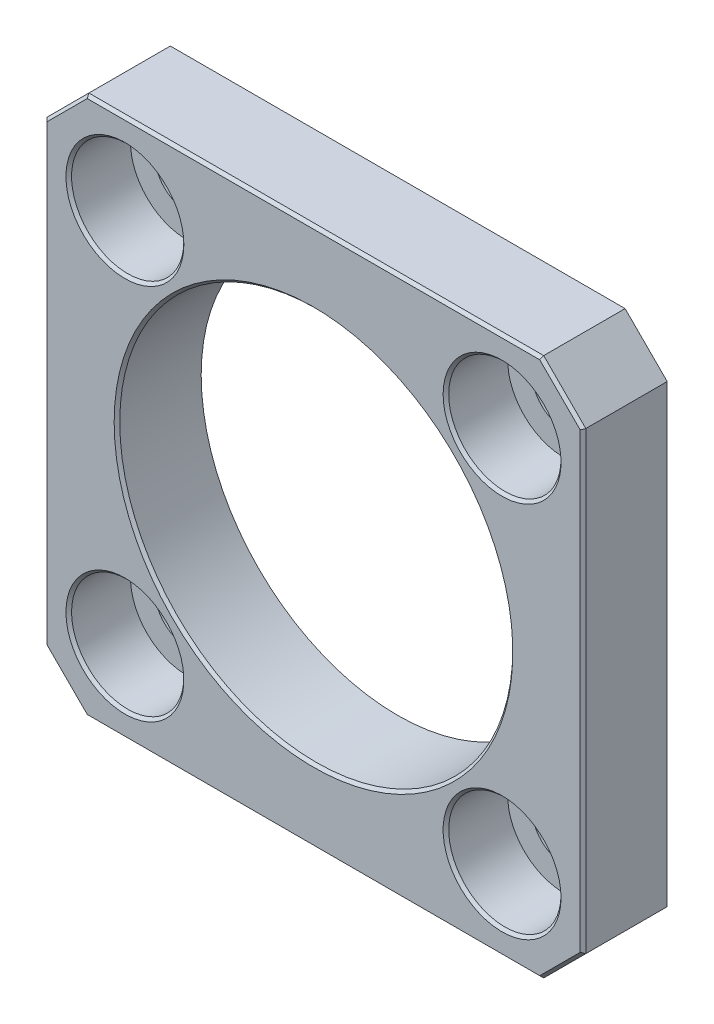
from build123d import *

# Parameters (mm, degrees)
SKETCH_1_R                   = 14
EXTRUDE_1_DEPTH              = 6
HOLE_WIZARD_M4_3_D           = 4.5
HOLE_WIZARD_M4_3_CBORE_D     = 8
HOLE_WIZARD_M4_3_CBORE_DEPTH = 4.4
PATTERN_CIRCULAR_1_COUNT     = 4
CHAMFER_1_SIZE               = 0.2


with BuildPart() as part:
    # 草圖1 → 填料-伸長1 (new body)
    with BuildSketch(Plane.XY):
        Polygon((-19.2, 16.2), (-16.2, 19.2), (16.2, 19.2), (19.2, 16.2), (19.2, -16.2), (16.2, -19.2), (-16.2, -19.2), (-19.2, -16.2), align=None)
        Circle(SKETCH_1_R, mode=Mode.SUBTRACT)
    extrude(amount=EXTRUDE_1_DEPTH)

    # M4 六角承窩頭蓋螺釘的柱孔3 (through all)
    with Locations(Plane.XY.offset(6)):
        with Locations((-13.435028843, 13.435028843)):
            hole_wizard_m4_3 = CounterBoreHole(HOLE_WIZARD_M4_3_D / 2, HOLE_WIZARD_M4_3_CBORE_D / 2, HOLE_WIZARD_M4_3_CBORE_DEPTH)

    # 環狀複製排列1: M4 六角承窩頭蓋螺釘的柱孔3 ×4 about axis
    pattern_circular_1_axis = Axis((0, 0, 0), (0, 0, 1))
    for i in range(1, PATTERN_CIRCULAR_1_COUNT):
        add(hole_wizard_m4_3.rotate(pattern_circular_1_axis, i * 360 / PATTERN_CIRCULAR_1_COUNT), mode=Mode.SUBTRACT)

    # 導角1
    chamfer_1_edges = [part.edges().sort_by_distance(p)[0] for p in [
        (0, -19.2, 6),
        (17.7, -17.7, 6),
        (19.2, 0, 6),
        (17.7, 17.7, 6),
        (-14, 0, 6),
        (0, 19.2, 6),
        (-17.7, 17.7, 6),
        (-17.435028843, 13.435028843, 6),
        (-13.435028843, -17.435028843, 6),
        (-19.2, 0, 6),
        (17.435028843, -13.435028843, 6),
        (13.435028843, 17.435028843, 6),
        (-17.7, -17.7, 6),
    ]]
    chamfer(chamfer_1_edges, length=CHAMFER_1_SIZE)


solid = part.part
